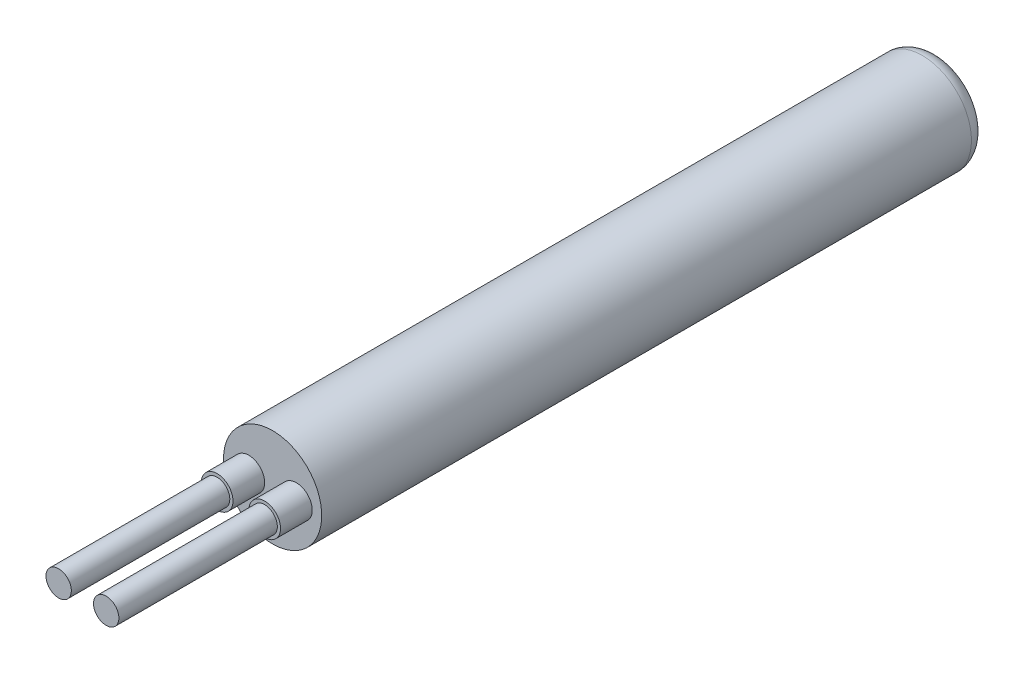
from build123d import *

# Parameters (mm, degrees)
CROQUIS1_R              = 1.55
SALIENTE_EXTRUIR1_DEPTH = 21
CROQUIS2_R              = 0.4
SALIENTE_EXTRUIR2_DEPTH = 6
CROQUIS3_R              = 0.5
CROQUIS3_R_2            = 0.4
SALIENTE_EXTRUIR3_DEPTH = 1
REDONDEO1_R             = 0.5


with BuildPart() as part:
    # Croquis1 → Saliente-Extruir1 (new body)
    with BuildSketch(Plane.XY):
        with Locations(Location((0, 0, 0), (0, 0, 180))):
            Circle(CROQUIS1_R)
    extrude(amount=SALIENTE_EXTRUIR1_DEPTH)

    # Croquis2 → Saliente-Extruir2 (add)
    with BuildSketch(Plane.XY.offset(21)):
        with Locations((0.75, 0)):
            Circle(CROQUIS2_R)
        with Locations((-0.75, 0)):
            Circle(CROQUIS2_R)
    extrude(amount=SALIENTE_EXTRUIR2_DEPTH)

    # Croquis3 → Saliente-Extruir3 (add)
    # profile 1 of 2: a face of its own
    with BuildSketch(Plane.XY.offset(21)):
        with Locations((-0.75, 0)):
            Circle(CROQUIS3_R)
        with Locations((-0.75, 0)):
            Circle(CROQUIS3_R_2, mode=Mode.SUBTRACT)
    # profile 2 of 2: a face of its own
    with BuildSketch(Plane.XY.offset(21)):
        with Locations((0.75, 0)):
            Circle(CROQUIS3_R)
        with Locations((0.75, 0)):
            Circle(CROQUIS3_R_2, mode=Mode.SUBTRACT)
    extrude(amount=SALIENTE_EXTRUIR3_DEPTH)

    # Redondeo1
    redondeo1_edges = [part.edges().sort_by_distance(p)[0] for p in [
        (1.55, 0, 0),
    ]]
    fillet(redondeo1_edges, radius=REDONDEO1_R)


solid = part.part
